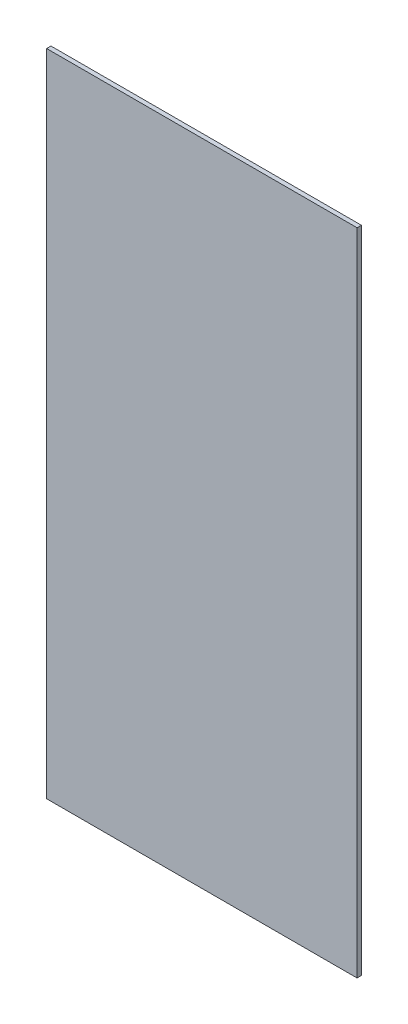
from build123d import *

# Parameters (mm, degrees)
SKETCH_2_W      = 215
SKETCH_2_H      = 450
EXTRUDE_1_DEPTH = 3


with BuildPart() as part:
    # 草图2 → 凸台-拉伸1 (new body)
    with BuildSketch(Plane.XY):
        Rectangle(SKETCH_2_W, SKETCH_2_H)
    extrude(amount=EXTRUDE_1_DEPTH)


solid = part.part
